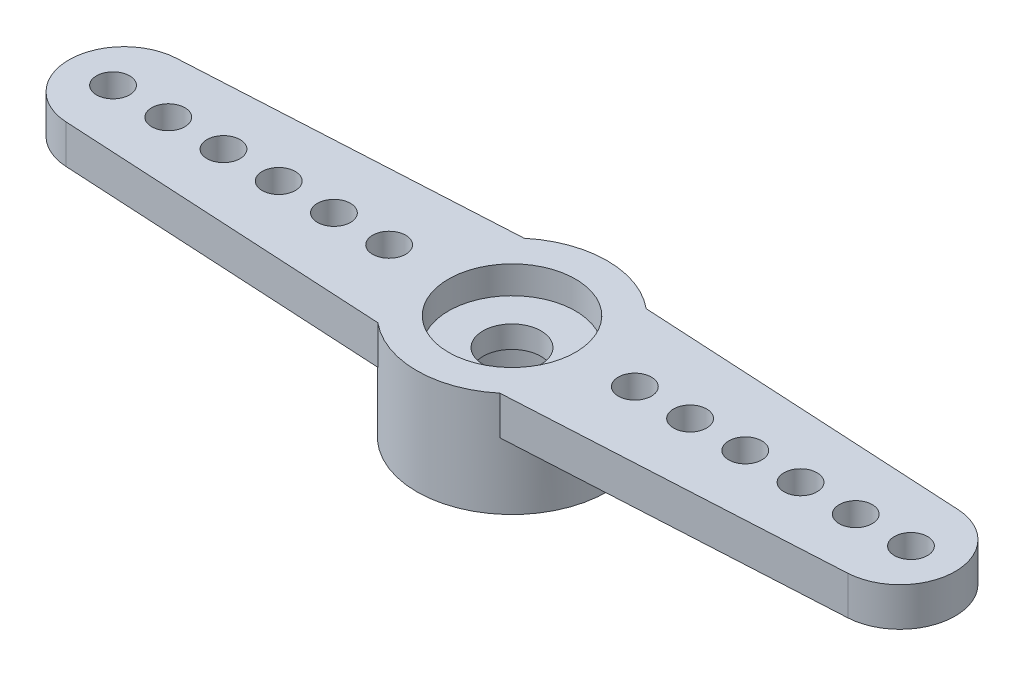
from build123d import *

# Parameters (mm, degrees)
RESSALTO_EXTRUS_O1_DEPTH = 1.4
ESBO_O2_R                = 3.45
RESSALTO_EXTRUS_O2_DEPTH = 2.4
FURO4_D                  = 1.2
PADR_O_LINEAR1_COUNT     = 6
PADR_O_LINEAR1_PITCH     = 2
PADR_OCIRCULAR2_COUNT    = 2
PADR_OCIRCULAR2_COPY_1_D = 1.2
PADR_OCIRCULAR2_COPY_2_D = 1.2
PADR_OCIRCULAR2_COPY_3_D = 1.2
PADR_OCIRCULAR2_COPY_4_D = 1.2
PADR_OCIRCULAR2_COPY_5_D = 1.2
FURO1_D                  = 4.95
FURO1_DEPTH              = 2
FURO2_D                  = 4.6
FURO2_DEPTH              = 1
FURO3_D                  = 2.1


with BuildPart() as part:
    # Esboço1 → Ressalto-extrusão1 (new body)
    with BuildSketch(Plane(origin=(0, 0, 0), x_dir=(1, 0, 0), z_dir=(0, 1, 0))):
        with BuildLine():
            Line((-14.159121967, 1.99702088), (-2.209072203, 2.65))
            ThreePointArc((-2.209072203, 2.65), (3.45, 0), (-2.209072203, -2.65))
            Line((-2.209072203, -2.65), (-14.159121967, -1.99702088))
            ThreePointArc((-14.159121967, -1.99702088), (-16.05, 0), (-14.159121967, 1.99702088))
        make_face()
    ressalto_extrus_o1 = extrude(amount=-RESSALTO_EXTRUS_O1_DEPTH)

    # Esboço2 → Ressalto-extrusão2 (add)
    with BuildSketch(Plane.XZ.offset(1.4)):
        with Locations(Location((0, 0, 0), (0, 0, 90))):
            Circle(ESBO_O2_R)
    extrude(amount=RESSALTO_EXTRUS_O2_DEPTH)

    # Furo4 (through all)
    with Locations(Plane(origin=(0, 0, 0), x_dir=(1, 0, 0), z_dir=(0, 1, 0))):
        with Locations((-14.45, 0)):
            furo4 = Hole(FURO4_D / 2)

    # Padrão linear1: Furo4 ×6
    with Locations(*[(i * PADR_O_LINEAR1_PITCH, 0, 0) for i in range(1, PADR_O_LINEAR1_COUNT)]):
        add(furo4, mode=Mode.SUBTRACT)

    # PadrãoCircular2: Ressalto-extrusão1, Furo4 ×2 about axis
    padr_ocircular2_axis = Axis((0, 0, 0), (0, 1, 0))
    add([ressalto_extrus_o1.rotate(padr_ocircular2_axis, i * 360 / PADR_OCIRCULAR2_COUNT) for i in range(1, PADR_OCIRCULAR2_COUNT)])
    add([furo4.rotate(padr_ocircular2_axis, i * 360 / PADR_OCIRCULAR2_COUNT) for i in range(1, PADR_OCIRCULAR2_COUNT)], mode=Mode.SUBTRACT)

    # PadrãoCircular2 copy 1 (through all)
    with Locations(Plane(origin=(-2, 0, 0), x_dir=(-1, 0, 0), z_dir=(0, 1, 0))):
        with Locations((-14.45, 0)):
            Hole(PADR_OCIRCULAR2_COPY_1_D / 2)

    # PadrãoCircular2 copy 2 (through all)
    with Locations(Plane(origin=(-4, 0, 0), x_dir=(-1, 0, 0), z_dir=(0, 1, 0))):
        with Locations((-14.45, 0)):
            Hole(PADR_OCIRCULAR2_COPY_2_D / 2)

    # PadrãoCircular2 copy 3 (through all)
    with Locations(Plane(origin=(-6, 0, 0), x_dir=(-1, 0, 0), z_dir=(0, 1, 0))):
        with Locations((-14.45, 0)):
            Hole(PADR_OCIRCULAR2_COPY_3_D / 2)

    # PadrãoCircular2 copy 4 (through all)
    with Locations(Plane(origin=(-8, 0, 0), x_dir=(-1, 0, 0), z_dir=(0, 1, 0))):
        with Locations((-14.45, 0)):
            Hole(PADR_OCIRCULAR2_COPY_4_D / 2)

    # PadrãoCircular2 copy 5 (through all)
    with Locations(Plane(origin=(-10, 0, 0), x_dir=(-1, 0, 0), z_dir=(0, 1, 0))):
        with Locations((-14.45, 0)):
            Hole(PADR_OCIRCULAR2_COPY_5_D / 2)

    # Furo1
    with Locations(Plane(origin=(0, -3.8, 0), x_dir=(-1, 0, 0), z_dir=(0, -1, 0))):
        with Locations((0, 0)):
            Hole(FURO1_D / 2, depth=FURO1_DEPTH)

    # Furo2
    with Locations(Plane(origin=(0, 0, 0), x_dir=(1, 0, 0), z_dir=(0, 1, 0))):
        with Locations((0, 0)):
            Hole(FURO2_D / 2, depth=FURO2_DEPTH)

    # Furo3 (through all)
    with Locations(Plane(origin=(0, 0, 0), x_dir=(1, 0, 0), z_dir=(0, 1, 0))):
        with Locations((0, 0)):
            Hole(FURO3_D / 2)


solid = part.part
